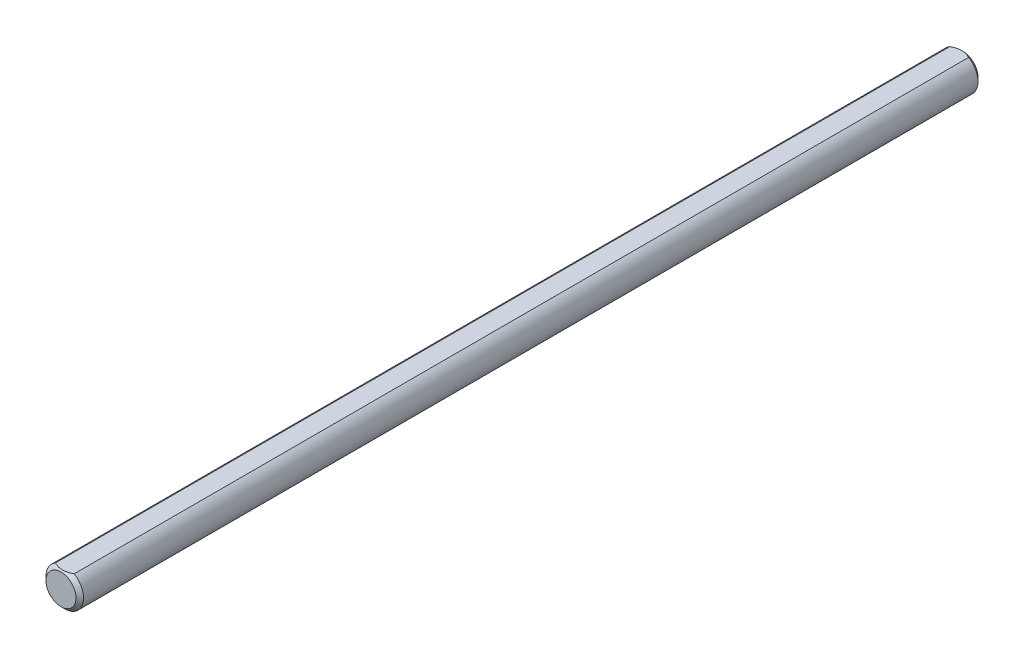
from build123d import *

# Parameters (mm, degrees)
SKETCH1_R           = 6.35
EXTRUDE1_DEPTH      = 152.4
CHAMFER1_SIZE       = 1.27
EXTRUDE7_DEPTH      = 153.664354058
EXTRUDE7_DEPTH_BACK = 153.664354058


with BuildPart() as part:
    # Sketch1 → Extrude1 (new, symmetric)
    with BuildSketch(Plane.XY):
        with Locations(Location((0, 0, 0), (0, 0, 180))):
            Circle(SKETCH1_R)
    extrude(amount=EXTRUDE1_DEPTH, both=True)

    # Chamfer1
    chamfer1_edges = [part.edges().sort_by_distance(p)[0] for p in [
        (6.35, 0, -152.4),
        (6.35, 0, 152.4),
    ]]
    chamfer(chamfer1_edges, length=CHAMFER1_SIZE)

    # Sketch13 → Extrude7 (cut, two sides: drawn at the far end of the back side and taken through both)
    with BuildSketch(Plane.XY.offset(-EXTRUDE7_DEPTH_BACK)):
        with BuildLine():
            Line((-3.175, 5.499261314), (3.175, 5.499261314))
            ThreePointArc((3.175, 5.499261314), (0, 6.35), (-3.175, 5.499261314))
        make_face()
    extrude(amount=EXTRUDE7_DEPTH + EXTRUDE7_DEPTH_BACK, mode=Mode.SUBTRACT)


solid = part.part
